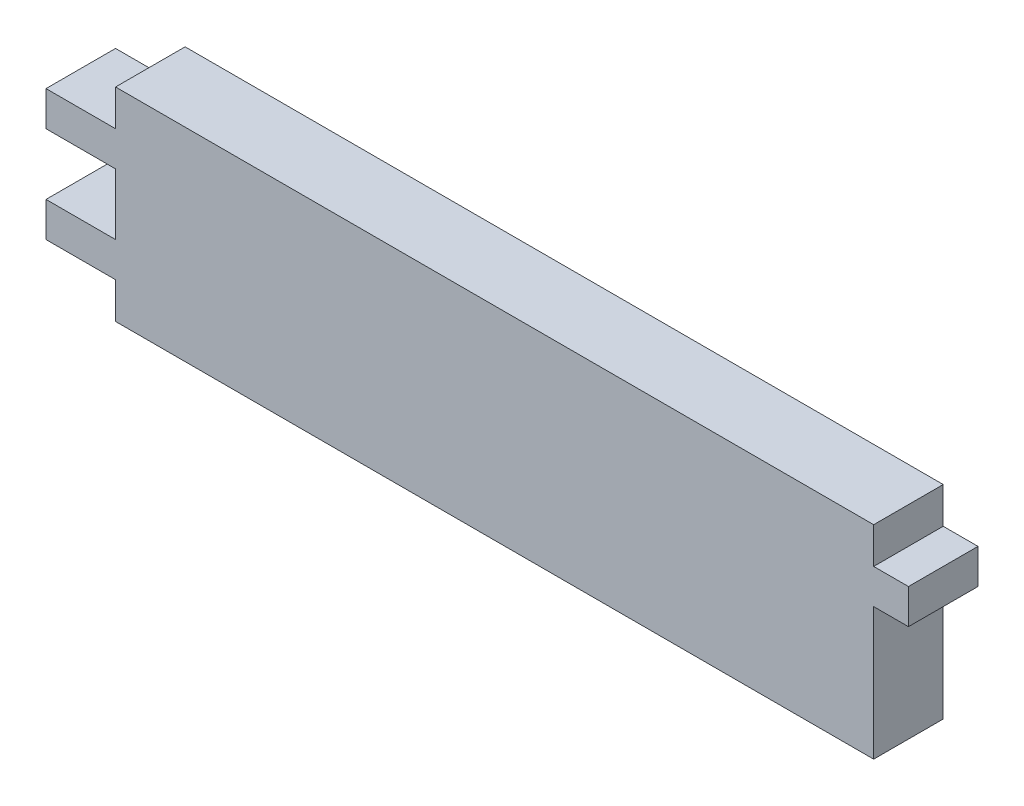
from build123d import *

# Parameters (mm, degrees)
BOSS_EXTRUDE1_DEPTH = 6.35


with BuildPart() as part:
    # Sketch1 → Boss-Extrude1 (new body)
    with BuildSketch(Plane.XY):
        Polygon((-75.840358597, 8.241696389), (-69.490358597, 8.241696389), (-69.490358597, 11.543696389), (-0.275358597, 11.543696389), (-0.275358597, 8.241696389), (2.899641403, 8.241696389), (2.899641403, 5.066696389), (-0.275358597, 5.066696389), (-0.275358597, -6.998303611), (-69.490358597, -6.998303611), (-69.490358597, -3.696303611), (-75.840358597, -3.696303611), (-75.840358597, -0.521303611), (-69.490358597, -0.521303611), (-69.490358597, 5.066696389), (-75.840358597, 5.066696389), align=None)
    extrude(amount=BOSS_EXTRUDE1_DEPTH)


solid = part.part
